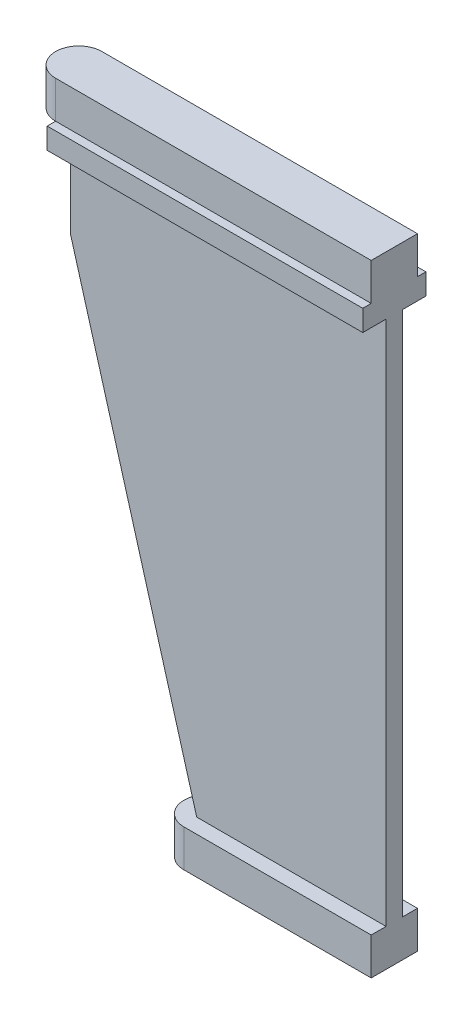
from build123d import *

# Parameters (mm, degrees)
BOSS_EXTRUDE1_DEPTH = 2.000000064
BOSS_EXTRUDE2_DEPTH = 4.4958
BOSS_EXTRUDE3_DEPTH = 4.4958
SKETCH4_W           = 38.1
SKETCH4_H           = 7.62
BOSS_EXTRUDE4_DEPTH = 2.54


with BuildPart() as part:
    # Sketch1 → Boss-Extrude1 (new body)
    with BuildSketch(Plane.XY):
        Polygon((0, 0), (-22.86, 0), (-38.1, 53.34), (-38.1, 66.04), (0, 66.04), align=None)
    extrude(amount=BOSS_EXTRUDE1_DEPTH)

    # Sketch2 → Boss-Extrude2 (add)
    with BuildSketch(Plane.XZ):
        with BuildLine():
            Line((0, -1.793999968), (-22.606, -1.793999968))
            ThreePointArc((-22.606, -1.793999968), (-25.4, 1.000000032), (-22.606, 3.794000032))
            Line((-22.606, 3.794000032), (0, 3.794000032))
            Line((0, 3.794000032), (0, -1.793999968))
        make_face()
    extrude(amount=BOSS_EXTRUDE2_DEPTH)

    # Sketch3 → Boss-Extrude3 (add)
    with BuildSketch(Plane(origin=(0, 66.04, 0), x_dir=(1, 0, 0), z_dir=(0, 1, 0))):
        with BuildLine():
            Line((0, 1.793999968), (0, -3.794000032))
            Line((0, -3.794000032), (-38.1, -3.794000032))
            ThreePointArc((-38.1, -3.794000032), (-40.894, -1.000000032), (-38.1, 1.793999968))
            Line((-38.1, 1.793999968), (0, 1.793999968))
        make_face()
    extrude(amount=BOSS_EXTRUDE3_DEPTH)

    # Sketch4 → Boss-Extrude4 (add)
    with BuildSketch(Plane.XZ.offset(-66.04)):
        with Locations((-19.05, 1.000000032)):
            Rectangle(SKETCH4_W, SKETCH4_H)
    extrude(amount=BOSS_EXTRUDE4_DEPTH)


solid = part.part
